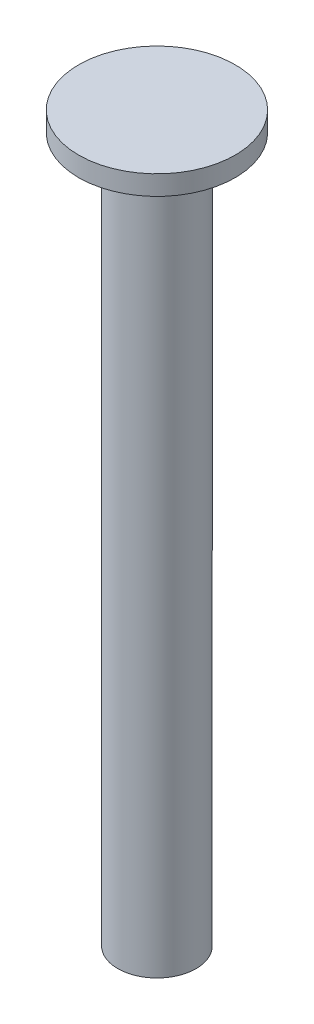
from build123d import *

# Parameters (mm, degrees)
SKETCH_1_R      = 2
EXTRUDE_1_DEPTH = 0.5
SKETCH_2_R      = 1
EXTRUDE_2_DEPTH = 18


with BuildPart() as part:
    # 草图1 → 凸台-拉伸1 (new body)
    with BuildSketch(Plane(origin=(0, 0, 0), x_dir=(1, 0, 0), z_dir=(0, 1, 0))):
        with Locations(Location((0, 0, 0), (0, 0, 270))):
            Circle(SKETCH_1_R)
    extrude(amount=EXTRUDE_1_DEPTH)

    # 草图2 → 凸台-拉伸2 (add)
    with BuildSketch(Plane.XZ):
        with Locations(Location((0, 0, 0), (0, 0, 90))):
            Circle(SKETCH_2_R)
    extrude(amount=EXTRUDE_2_DEPTH)


solid = part.part
